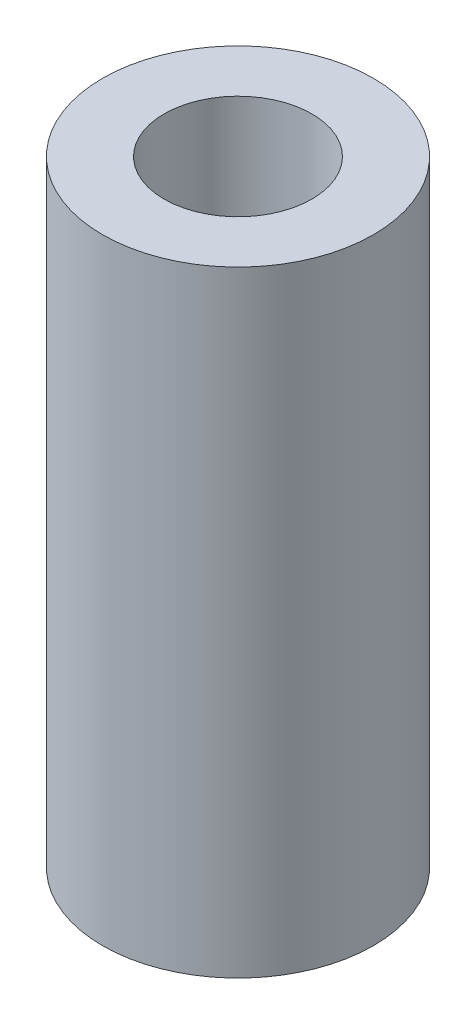
from build123d import *

# Parameters (mm, degrees)
SKETCH1_R           = 3.3
SKETCH1_R_2         = 1.8
BOSS_EXTRUDE1_DEPTH = 15


with BuildPart() as part:
    # Sketch1 → Boss-Extrude1 (new body)
    with BuildSketch(Plane(origin=(0, 0, 0), x_dir=(1, 0, 0), z_dir=(0, 1, 0))):
        with Locations(Location((0, 0, 0), (0, 0, 270))):
            Circle(SKETCH1_R)
        with Locations(Location((0, 0, 0), (0, 0, 270))):
            Circle(SKETCH1_R_2, mode=Mode.SUBTRACT)
    extrude(amount=BOSS_EXTRUDE1_DEPTH)


solid = part.part
